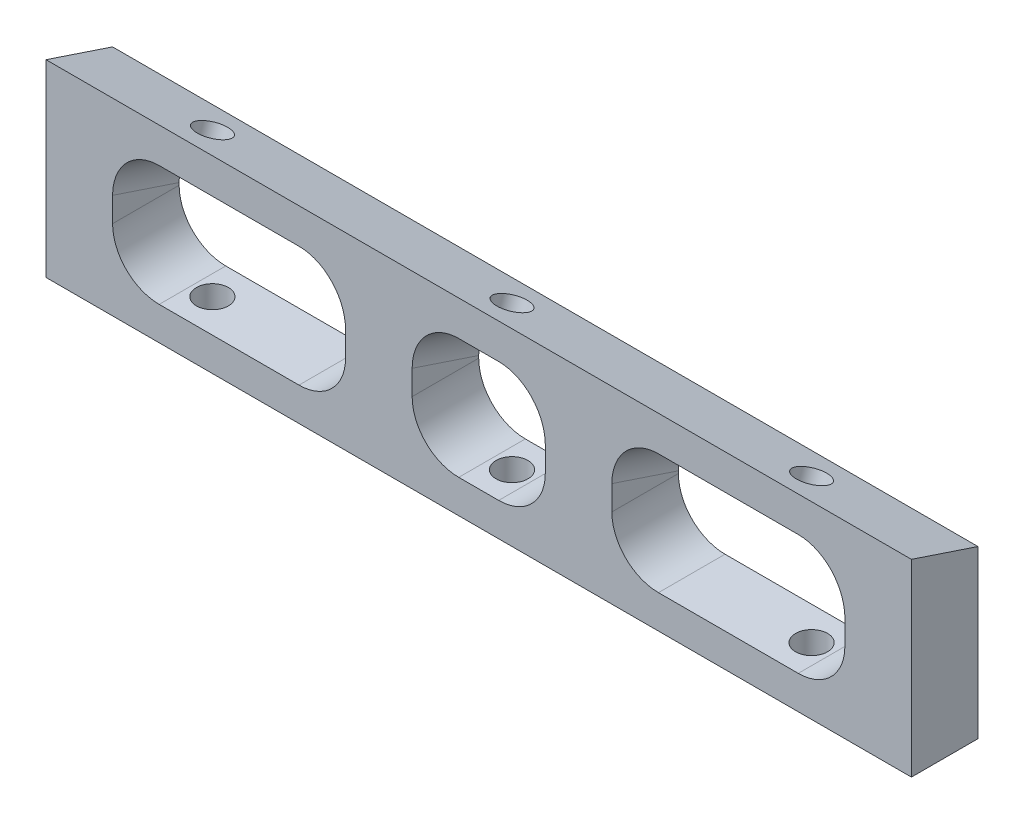
from build123d import *

# Parameters (mm, degrees)
ESQUISSE1_W             = 10
ESQUISSE1_H             = 5
BOSS_EXTRU_1_DEPTH      = 110
BOSS_EXTRU_2_DEPTH      = 10
BOSS_EXTRU_3_DEPTH      = 10
ESQUISSE4_W             = 10
ESQUISSE4_H             = 25
BOSS_EXTRU_4_DEPTH      = 10
ESQUISSE5_R             = 2.4
ENL_V_MAT_EXTRU_1_DEPTH = 10
ESQUISSE6_R             = 2.4
ENL_V_MAT_EXTRU_2_DEPTH = 10
CONG_1_R                = 7


with BuildPart() as part:
    # Esquisse1 → Boss.-Extru.1 (new body)
    with BuildSketch(Plane(origin=(0, 0, 0), x_dir=(0, 0, -1), z_dir=(1, 0, 0))):
        Polygon((10, 0), (0, 3.332373658), (0, 0), align=None)
        Polygon((0, 0), (0, -1.93793739), (10, -5.270311049), (10, 0), align=None)
        with Locations((5, -22.5)):
            Rectangle(ESQUISSE1_W, ESQUISSE1_H)
    extrude(amount=BOSS_EXTRU_1_DEPTH)

    # Esquisse2 → Boss.-Extru.2 (add)
    with BuildSketch(Plane.ZY):
        Polygon((0, 3.332373658), (-10, 0), (0, 0), align=None)
        Polygon((0, 0), (-10, 0), (-10, -5.270311049), (0, -1.93793739), align=None)
        Polygon((0, -1.93793739), (-10, -5.270311049), (-10, -25), (0, -25), align=None)
    extrude(amount=BOSS_EXTRU_2_DEPTH)

    # Esquisse3 → Boss.-Extru.3 (add)
    with BuildSketch(Plane(origin=(110, 0, 0), x_dir=(0, 0, -1), z_dir=(1, 0, 0))):
        Polygon((0, 0), (10, 0), (0, 3.332373658), align=None)
        Polygon((10, -5.270311049), (10, 0), (0, 0), (0, -1.93793739), align=None)
        Polygon((10, -25), (10, -5.270311049), (0, -1.93793739), (0, -25), align=None)
    extrude(amount=BOSS_EXTRU_3_DEPTH)

    # Esquisse4 → Boss.-Extru.4 (add)
    with BuildSketch(Plane(origin=(0, 0, -10), x_dir=(-1, 0, 0), z_dir=(0, 0, -1))):
        with Locations((-70, -12.5)):
            Rectangle(ESQUISSE4_W, ESQUISSE4_H)
        with Locations((-40, -12.5)):
            Rectangle(ESQUISSE4_W, ESQUISSE4_H)
    extrude(amount=-BOSS_EXTRU_4_DEPTH)

    # Esquisse5 → Enlèv. mat.-Extru.1 (cut)
    with BuildSketch(Plane(origin=(0, 2.999308969, -0.99948182), x_dir=(1, 0, 0), z_dir=(0, 0.948710608132916, -0.3161458239737997))):
        with Locations(Location((10, 4.216795033, 0), (0, 0, 270))):
            Circle(ESQUISSE5_R)
        with Locations(Location((55, 4.216795033, 0), (0, 0, 270))):
            Circle(ESQUISSE5_R)
        with Locations(Location((100, 4.216795033, 0), (0, 0, 270))):
            Circle(ESQUISSE5_R)
    extrude(amount=-ENL_V_MAT_EXTRU_1_DEPTH, mode=Mode.SUBTRACT)

    # Esquisse6 → Enlèv. mat.-Extru.2 (cut)
    with BuildSketch(Plane.XZ.offset(25)):
        with Locations(Location((10, -5, 0), (0, 0, 270))):
            Circle(ESQUISSE6_R)
        with Locations(Location((55, -5, 0), (0, 0, 270))):
            Circle(ESQUISSE6_R)
        with Locations(Location((100, -5, 0), (0, 0, 270))):
            Circle(ESQUISSE6_R)
    extrude(amount=-ENL_V_MAT_EXTRU_2_DEPTH, mode=Mode.SUBTRACT)

    # Congé1
    cong_1_edges = [part.edges().sort_by_distance(p)[0] for p in [
        (75, -20, -5),
        (65, -20, -5),
        (75, -3.60412422, -5),
        (65, -3.60412422, -5),
        (110, -3.60412422, -5),
        (110, -20, -5),
        (0, -20, -5),
        (0, -3.60412422, -5),
        (35, -20, -5),
        (45, -20, -5),
        (45, -3.60412422, -5),
        (35, -3.60412422, -5),
    ]]
    fillet(cong_1_edges, radius=CONG_1_R)


solid = part.part
